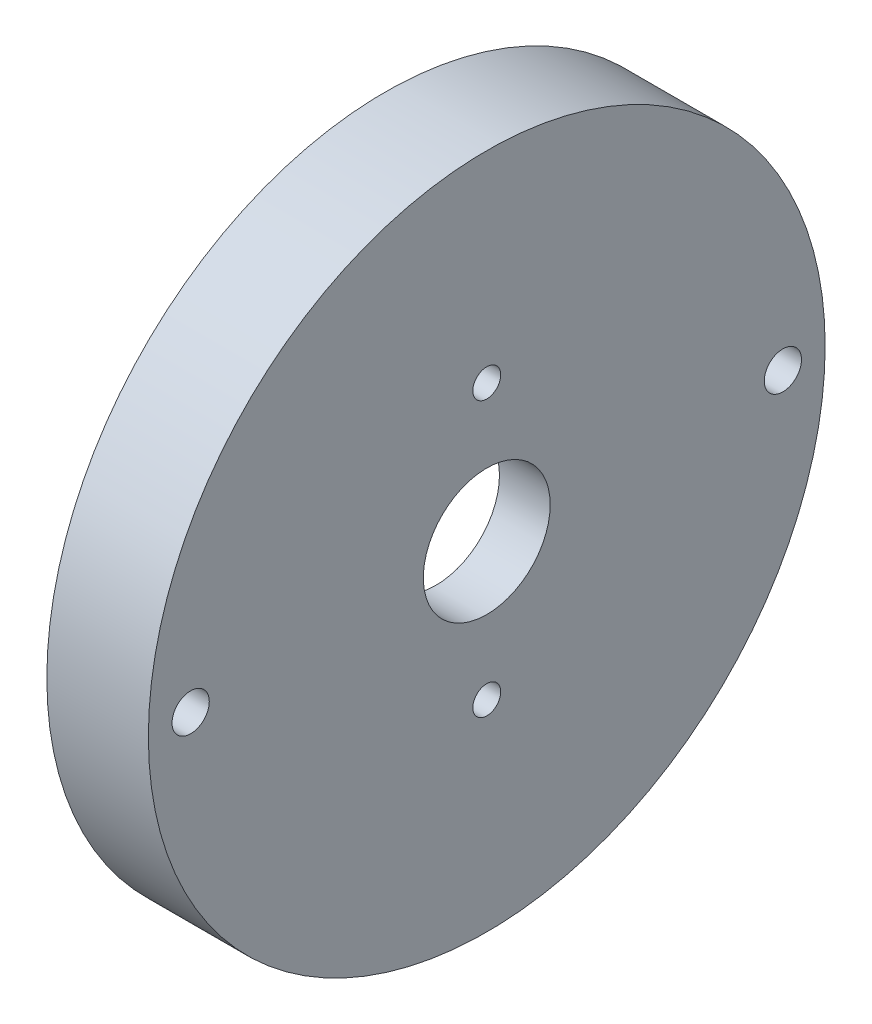
from build123d import *

# Parameters (mm, degrees)
SKETCH1_R                      = 40
SKETCH1_R_2                    = 27.5
BOSS_EXTRUDE1_DEPTH            = 6
SKETCH4_R                      = 40
SKETCH4_R_2                    = 1.65
SKETCH4_R_3                    = 7.5
BOSS_EXTRUDE3_DEPTH            = 6
CBORE_FOR_M2_SHCS1_D           = 2.4
CBORE_FOR_M2_SHCS1_DEPTH       = 12
CBORE_FOR_M2_SHCS1_CBORE_D     = 4.4
CBORE_FOR_M2_SHCS1_CBORE_DEPTH = 8.25


with BuildPart() as part:
    # Sketch1 → Boss-Extrude1 (new body)
    with BuildSketch(Plane(origin=(0, 0, 0), x_dir=(0, 0, -1), z_dir=(1, 0, 0))):
        Circle(SKETCH1_R)
        Circle(SKETCH1_R_2, mode=Mode.SUBTRACT)
    extrude(amount=BOSS_EXTRUDE1_DEPTH)

    # Sketch4 → Boss-Extrude3 (add)
    with BuildSketch(Plane(origin=(6, 0, 8), x_dir=(0, 1, 0), z_dir=(1, 0, 0))):
        with Locations(Location((0, -8, 0), (0, 0, 270))):
            Circle(SKETCH4_R)
        with Locations(Location((-16.22, -8, 0), (0, 0, 270))):
            Circle(SKETCH4_R_2, mode=Mode.SUBTRACT)
        with Locations(Location((16.22, -8, 0), (0, 0, 270))):
            Circle(SKETCH4_R_2, mode=Mode.SUBTRACT)
        with Locations(Location((0, -8, 0), (0, 0, 270))):
            Circle(SKETCH4_R_3, mode=Mode.SUBTRACT)
    extrude(amount=BOSS_EXTRUDE3_DEPTH)

    # CBORE for M2 SHCS1
    with Locations(Plane(origin=(12, 0, 0), x_dir=(0, 0, -1), z_dir=(1, 0, 0))):
        with Locations((0, 0), (-35, 0), (35, 0)):
            CounterBoreHole(CBORE_FOR_M2_SHCS1_D / 2, CBORE_FOR_M2_SHCS1_CBORE_D / 2, CBORE_FOR_M2_SHCS1_CBORE_DEPTH, depth=CBORE_FOR_M2_SHCS1_DEPTH)


solid = part.part
